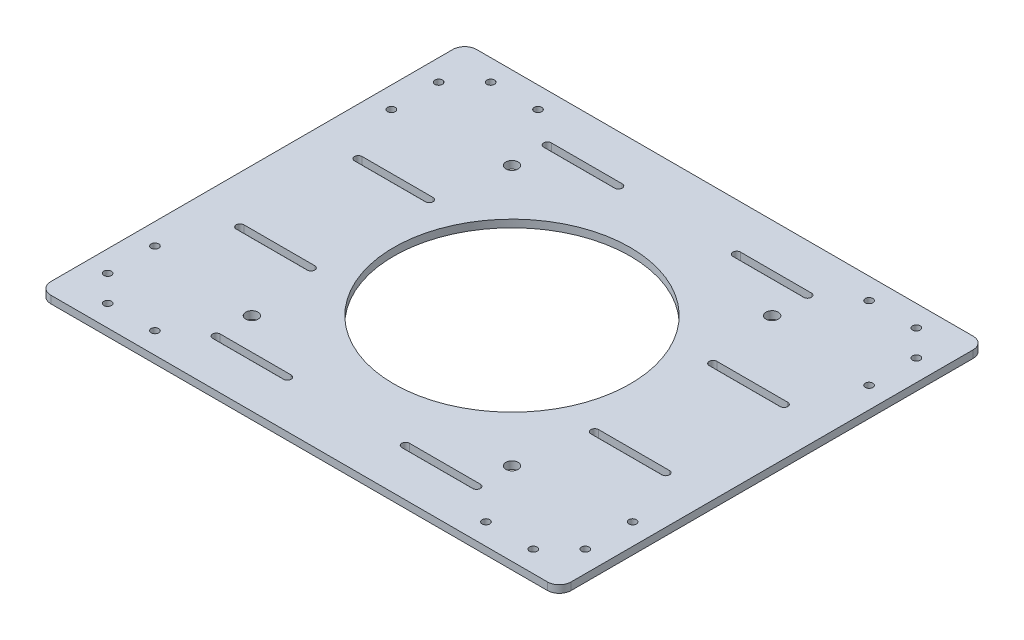
from build123d import *

# Parameters (mm, degrees)
SKETCH1_W               = 220
SKETCH1_H               = 180
BOSS_EXTRUDE1_DEPTH     = 3.175
FILLET1_R               = 5
SKETCH2_R               = 50
CUT_EXTRUDE1_DEPTH      = 10
SKETCH5_R               = 1.6
CUT_EXTRUDE3_DEPTH      = 10
MIRROR2_COPY_1_SKETCH_R = 1.6
MIRROR2_COPY_1_DEPTH    = 10
SKETCH7_R               = 2.6
CUT_EXTRUDE4_DEPTH      = 10
CUT_EXTRUDE5_DEPTH      = 10
CUT_EXTRUDE6_DEPTH      = 10


with BuildPart() as part:
    # Sketch1 → Boss-Extrude1 (new body)
    with BuildSketch(Plane(origin=(0, 0, 0), x_dir=(1, 0, 0), z_dir=(0, 1, 0))):
        Rectangle(SKETCH1_W, SKETCH1_H)
    extrude(amount=BOSS_EXTRUDE1_DEPTH)

    # Fillet1
    fillet1_edges = [part.edges().sort_by_distance(p)[0] for p in [
        (-110, 1.5875, -90),
        (110, 1.5875, -90),
        (110, 1.5875, 90),
        (-110, 1.5875, 90),
    ]]
    fillet(fillet1_edges, radius=FILLET1_R)

    # Sketch2 → Cut-Extrude1 (cut)
    with BuildSketch(Plane(origin=(0, 3.175, 0), x_dir=(1, 0, 0), z_dir=(0, 1, 0))):
        with Locations(Location((0, 0, 0), (0, 0, 270))):
            Circle(SKETCH2_R)
    extrude(amount=-CUT_EXTRUDE1_DEPTH, mode=Mode.SUBTRACT)

    # Sketch5 → Cut-Extrude3 (cut)
    with BuildSketch(Plane(origin=(0, 3.175, 0), x_dir=(1, 0, 0), z_dir=(0, 1, 0))):
        with Locations(Location((-70, 81, 0), (0, 0, 270))):
            Circle(SKETCH5_R)
        with Locations(Location((-90, 81, 0), (0, 0, 270))):
            Circle(SKETCH5_R)
        with Locations(Location((-101, 70, 0), (0, 0, 270))):
            Circle(SKETCH5_R)
        with Locations(Location((-101, 50, 0), (0, 0, 270))):
            Circle(SKETCH5_R)
    cut_extrude3 = extrude(amount=-CUT_EXTRUDE3_DEPTH, mode=Mode.SUBTRACT)

    # Mirror1: Cut-Extrude3 across plane
    add(cut_extrude3.mirror(Plane(origin=(0, 0, 0), x_dir=(0, 0, 1), z_dir=(1, 0, 0))), mode=Mode.SUBTRACT)

    # Mirror2: Cut-Extrude3 across plane
    add(cut_extrude3.mirror(Plane.XY), mode=Mode.SUBTRACT)

    # Mirror2 copy 1 sketch → Mirror2 copy 1 (cut)
    with BuildSketch(Plane(origin=(0, 3.175, 0), x_dir=(-1, 0, 0), z_dir=(0, 1, 0))):
        with Locations(Location((-70, 81, 0), (0, 0, 270))):
            Circle(MIRROR2_COPY_1_SKETCH_R)
        with Locations(Location((-90, 81, 0), (0, 0, 270))):
            Circle(MIRROR2_COPY_1_SKETCH_R)
        with Locations(Location((-101, 70, 0), (0, 0, 270))):
            Circle(MIRROR2_COPY_1_SKETCH_R)
        with Locations(Location((-101, 50, 0), (0, 0, 270))):
            Circle(MIRROR2_COPY_1_SKETCH_R)
    extrude(amount=-MIRROR2_COPY_1_DEPTH, mode=Mode.SUBTRACT)

    # Sketch7 → Cut-Extrude4 (cut)
    with BuildSketch(Plane(origin=(0, 3.175, 0), x_dir=(1, 0, 0), z_dir=(0, 1, 0))):
        with Locations(Location((-55, 55, 0), (0, 0, 270))):
            Circle(SKETCH7_R)
        with Locations(Location((55, 55, 0), (0, 0, 270))):
            Circle(SKETCH7_R)
        with Locations(Location((55, -55, 0), (0, 0, 270))):
            Circle(SKETCH7_R)
        with Locations(Location((-55, -55, 0), (0, 0, 270))):
            Circle(SKETCH7_R)
    extrude(amount=-CUT_EXTRUDE4_DEPTH, mode=Mode.SUBTRACT)

    # Sketch8 → Cut-Extrude5 (cut)
    with BuildSketch(Plane(origin=(0, 3.175, 0), x_dir=(1, 0, 0), z_dir=(0, 1, 0))):
        with BuildLine():
            Line((-55, 71.6), (-25, 71.6))
            ThreePointArc((-25, 71.6), (-23.4, 70), (-25, 68.4))
            Line((-25, 68.4), (-55, 68.4))
            ThreePointArc((-55, 68.4), (-56.6, 70), (-55, 71.6))
        make_face()
        with BuildLine():
            Line((55, 68.4), (25, 68.4))
            ThreePointArc((25, 68.4), (23.4, 70), (25, 71.6))
            Line((25, 71.6), (55, 71.6))
            ThreePointArc((55, 71.6), (56.6, 70), (55, 68.4))
        make_face()
    cut_extrude5 = extrude(amount=-CUT_EXTRUDE5_DEPTH, mode=Mode.SUBTRACT)

    # Mirror3: Cut-Extrude5 across plane
    add(cut_extrude5.mirror(Plane.XY), mode=Mode.SUBTRACT)

    # Sketch10 → Cut-Extrude6 (cut)
    with BuildSketch(Plane(origin=(0, 3.175, 0), x_dir=(1, 0, 0), z_dir=(0, 1, 0))):
        with BuildLine():
            Line((-60, 23.4), (-90, 23.4))
            ThreePointArc((-90, 23.4), (-91.6, 25), (-90, 26.6))
            Line((-90, 26.6), (-60, 26.6))
            ThreePointArc((-60, 26.6), (-58.4, 25), (-60, 23.4))
        make_face()
        with BuildLine():
            Line((-90, -23.4), (-60, -23.4))
            ThreePointArc((-60, -23.4), (-58.4, -25), (-60, -26.6))
            Line((-60, -26.6), (-90, -26.6))
            ThreePointArc((-90, -26.6), (-91.6, -25), (-90, -23.4))
        make_face()
    cut_extrude6 = extrude(amount=-CUT_EXTRUDE6_DEPTH, mode=Mode.SUBTRACT)

    # Mirror4: Cut-Extrude6 across plane
    add(cut_extrude6.mirror(Plane(origin=(0, 0, 0), x_dir=(0, 0, 1), z_dir=(1, 0, 0))), mode=Mode.SUBTRACT)


solid = part.part
